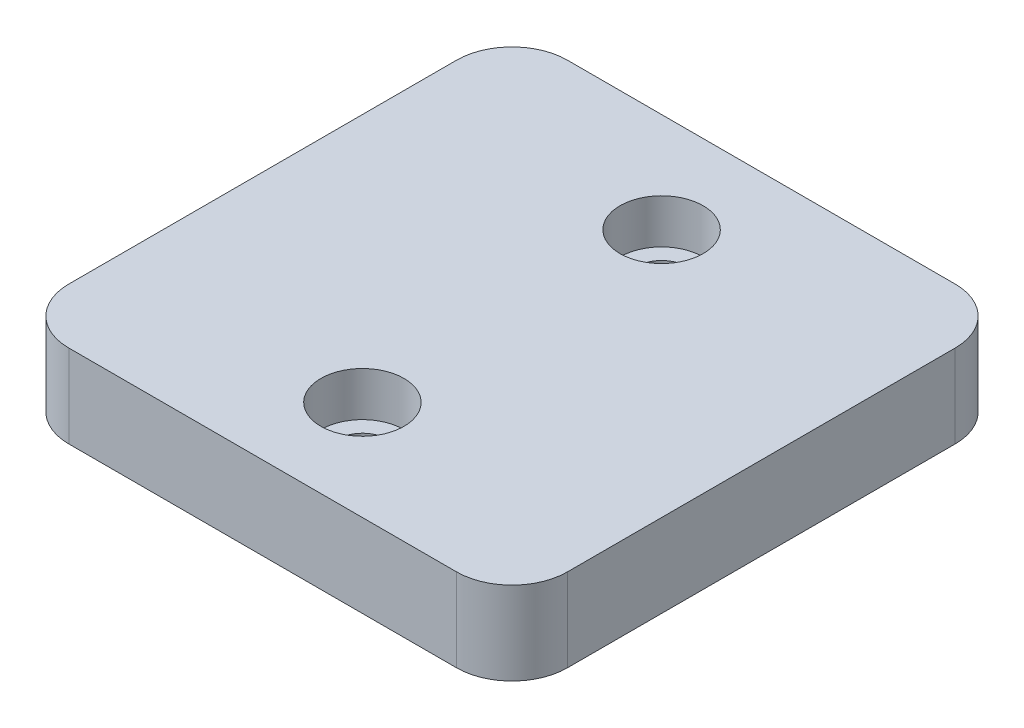
from build123d import *

# Parameters (mm, degrees)
EXTRUDE_2_DEPTH     = 15
SKETCH_3_R          = 7.5
CUT_EXTRUDE_1_DEPTH = 8
SKETCH_4_R          = 4.5
CUT_EXTRUDE_2_DEPTH = 66.383484153


with BuildPart() as part:
    # 草图2 → 凸台-拉伸2 (new body)
    with BuildSketch(Plane(origin=(0, 0, 0), x_dir=(1, 0, 0), z_dir=(0, 1, 0))):
        with BuildLine():
            Line((-35, 45), (35, 45))
            ThreePointArc((35, 45), (42.071067812, 42.071067812), (45, 35))
            Line((45, 35), (45, -35))
            ThreePointArc((45, -35), (42.071067812, -42.071067812), (35, -45))
            Line((35, -45), (-35, -45))
            ThreePointArc((-35, -45), (-42.071067812, -42.071067812), (-45, -35))
            Line((-45, -35), (-45, 35))
            ThreePointArc((-45, 35), (-42.071067812, 42.071067812), (-35, 45))
        make_face()
    extrude(amount=EXTRUDE_2_DEPTH)

    # 草图3 → 切除-拉伸1 (cut)
    with BuildSketch(Plane(origin=(0, 15, 0), x_dir=(1, 0, 0), z_dir=(0, 1, 0))):
        with Locations(Location((0, 27, 0), (0, 0, 270))):
            Circle(SKETCH_3_R)
        with Locations(Location((0, -27, 0), (0, 0, 90))):
            Circle(SKETCH_3_R)
    extrude(amount=-CUT_EXTRUDE_1_DEPTH, mode=Mode.SUBTRACT)

    # 草图4 → 切除-拉伸2 (cut, through all)
    with BuildSketch(Plane.XZ):
        with Locations(Location((0, 27, 0), (0, 0, 270))):
            Circle(SKETCH_4_R)
        with Locations(Location((0, -27, 0), (0, 0, 90))):
            Circle(SKETCH_4_R)
    extrude(amount=-CUT_EXTRUDE_2_DEPTH, mode=Mode.SUBTRACT)


solid = part.part
